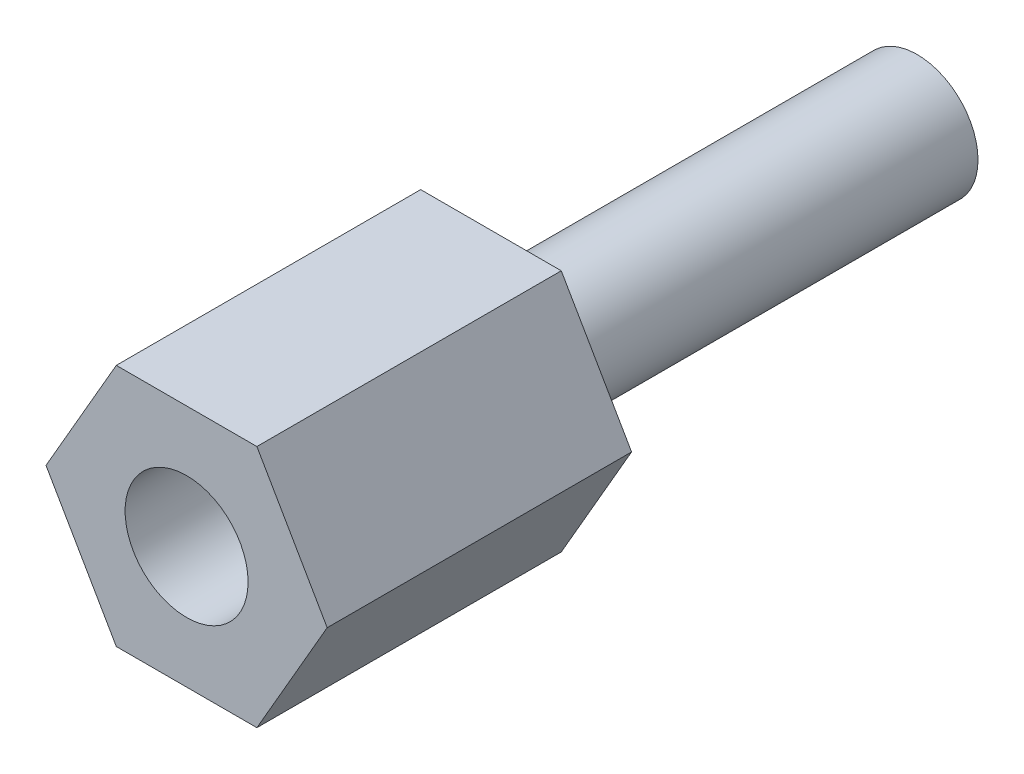
from build123d import *

# Parameters (mm, degrees)
FEMALE_HEX_STANDOFF_SKETCH_R  = 1.01
FEMALE_HEX_STANDOFF_DEPTH     = 5
STUD_ROOT_SKETCH_R            = 1.35
STUD_ROOT_DEPTH               = 0.45
MALE_THREAD_ENVELOPE_START    = -7
MALE_THREAD_ENVELOPE_SKETCH_R = 1
MALE_THREAD_ENVELOPE_DEPTH    = 7


with BuildPart() as part:
    # Female_hex_standoff_Sketch → Female_hex_standoff (new body)
    with BuildSketch(Plane.XY):
        Polygon((2.309401077, 0), (1.154700538, 2), (-1.154700538, 2), (-2.309401077, 0), (-1.154700538, -2), (1.154700538, -2), align=None)
        Circle(FEMALE_HEX_STANDOFF_SKETCH_R, mode=Mode.SUBTRACT)
    extrude(amount=FEMALE_HEX_STANDOFF_DEPTH)

    # Stud_root_Sketch → Stud_root (add)
    with BuildSketch(Plane.XY):
        Circle(STUD_ROOT_SKETCH_R)
    extrude(amount=STUD_ROOT_DEPTH)

    # Male_thread_envelope_Sketch → Male_thread_envelope (add)
    with BuildSketch(Plane.XY.offset(MALE_THREAD_ENVELOPE_START)):
        Circle(MALE_THREAD_ENVELOPE_SKETCH_R)
    extrude(amount=MALE_THREAD_ENVELOPE_DEPTH)


solid = part.part
